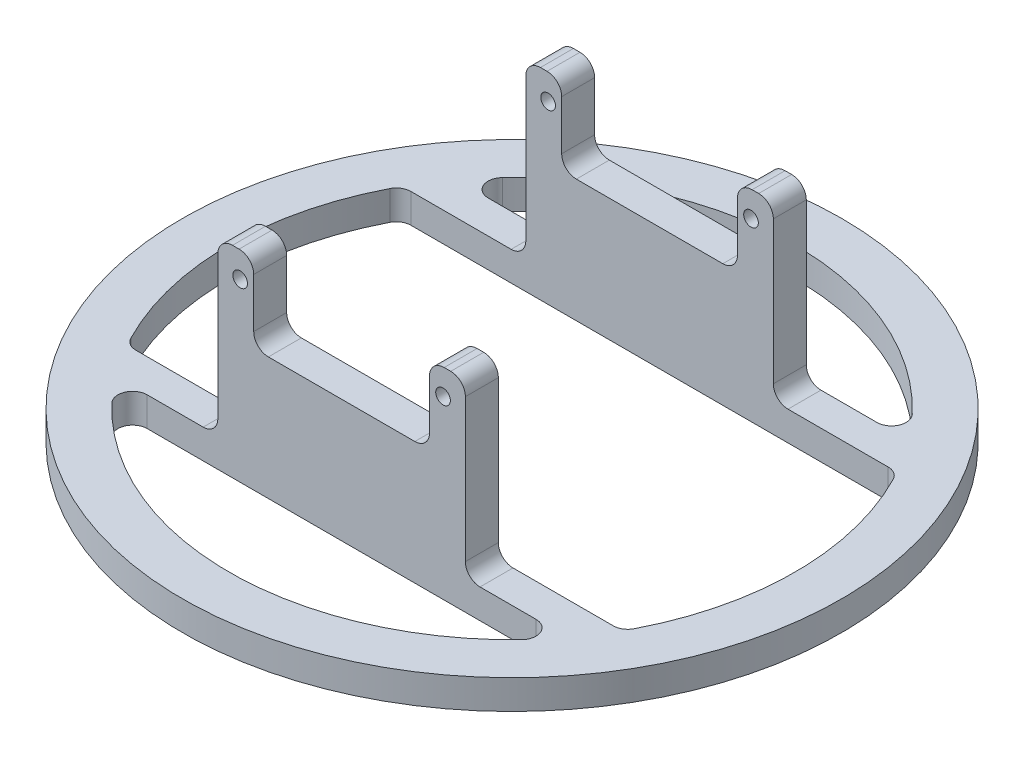
from build123d import *

# Parameters (mm, degrees)
SKETCH1_R           = 1
BOSS_EXTRUDE1_DEPTH = 4.5
SKETCH4_R           = 45
BOSS_EXTRUDE3_DEPTH = 4
FILLET2_R           = 2
FILLET3_R           = 2


with BuildPart() as part:
    # Sketch1 → Boss-Extrude1 (new body)
    with BuildSketch(Plane.XY):
        Polygon((12, 3.5), (16.9, 3.5), (16.9, -20), (-16.9, -20), (-16.9, 3.5), (-12, 3.5), (-12, -7.25), (12, -7.25), align=None)
        with Locations((13.85, 0)):
            Circle(SKETCH1_R, mode=Mode.SUBTRACT)
        with Locations((-13.85, 0)):
            Circle(SKETCH1_R, mode=Mode.SUBTRACT)
    boss_extrude1 = extrude(amount=BOSS_EXTRUDE1_DEPTH)

    # Sketch4 → Boss-Extrude3 (add)
    with BuildSketch(Plane(origin=(0, -20, 0), x_dir=(-1, 0, 0), z_dir=(0, -1, 0))):
        with Locations(Location((0, 18.775, 0), (0, 0, 90))):
            Circle(SKETCH4_R)
        with BuildLine():
            Line((-33.78345564, 0), (33.78345564, 0))
            ThreePointArc((33.78345564, 0), (38.65, 18.775), (33.78345564, 37.55))
            Line((33.78345564, 37.55), (-33.78345564, 37.55))
            ThreePointArc((-33.78345564, 37.55), (-38.65, 18.775), (-33.78345564, 0))
        make_face(mode=Mode.SUBTRACT)
        with BuildLine():
            Line((-30.85606707, -4.5), (30.85606707, -4.5))
            ThreePointArc((30.85606707, -4.5), (0, -19.875), (-30.85606707, -4.5))
        make_face(mode=Mode.SUBTRACT)
        with BuildLine():
            Line((-30.85606707, 42.05), (30.85606707, 42.05))
            ThreePointArc((30.85606707, 42.05), (0, 57.425), (-30.85606707, 42.05))
        make_face(mode=Mode.SUBTRACT)
    extrude(amount=BOSS_EXTRUDE3_DEPTH)

    # Mirror2: Boss-Extrude1 across plane
    add(boss_extrude1.mirror(Plane(origin=(0, 0, -18.775), x_dir=(1, 0, 0), z_dir=(0, 0, -1))))

    # Fillet2
    fillet2_edges = [part.edges().sort_by_distance(p)[0] for p in [
        (-12, -7.25, 2.25),
        (12, -7.25, 2.25),
        (33.78345564, -22, 0),
        (-33.78345564, -22, 0),
        (-33.78345564, -22, -37.55),
        (33.78345564, -22, -37.55),
        (-30.85606707, -22, 4.5),
        (30.85606707, -22, 4.5),
        (30.85606707, -22, -42.05),
        (-30.85606707, -22, -42.05),
        (-12, -7.25, -39.8),
        (12, -7.25, -39.8),
    ]]
    fillet(fillet2_edges, radius=FILLET2_R)

    # Fillet3
    fillet3_edges = [part.edges().sort_by_distance(p)[0] for p in [
        (12, 3.5, 2.25),
        (16.9, 3.5, 2.25),
        (16.9, -20, 2.25),
        (-16.9, -20, 2.25),
        (-16.9, 3.5, 2.25),
        (-12, 3.5, 2.25),
        (-12, 3.5, -39.8),
        (12, 3.5, -39.8),
        (16.9, 3.5, -39.8),
        (16.9, -20, -39.8),
        (-16.9, -20, -39.8),
        (-16.9, 3.5, -39.8),
    ]]
    fillet(fillet3_edges, radius=FILLET3_R)


solid = part.part
